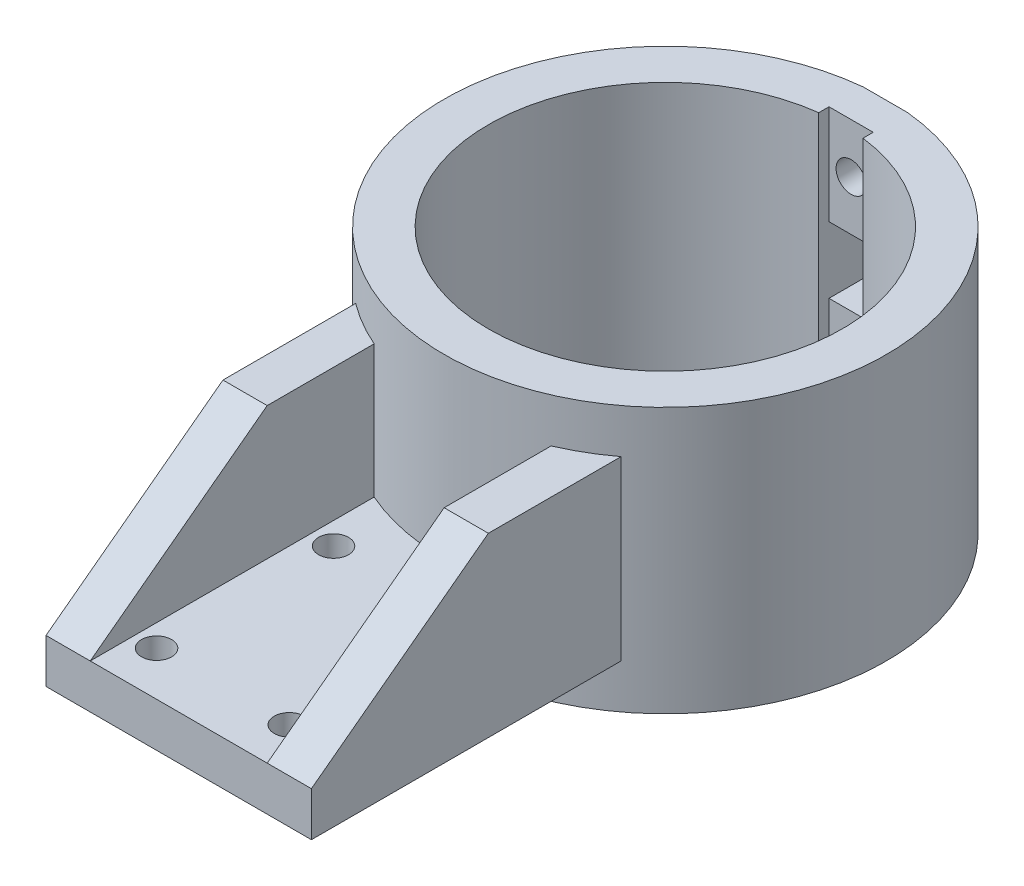
from build123d import *

# Parameters (mm, degrees)
SKETCH1_R             = 50
SKETCH1_R_2           = 40
EXTRUDE1_DEPTH        = 60
EXTRUDE2_REACH        = 128.886
EXTRUDE2_END_RADIUS   = 50
EXTRUDE5_DEPTH        = 60
EXTRUDE6_DEPTH        = 149.660687473
EXTRUDE6_DEPTH_BACK   = 149.660687473
SKETCH10_W            = 10
SKETCH10_H            = 4
SKETCH10_H_2          = 0.50125629
EXTRUDE7_DEPTH        = 135.907375632
EXTRUDE8_REACH        = 179.82
SKETCH11_W            = 10
SKETCH11_H            = 15
M8_TAPPED_HOLE2_D     = 6.8
M8_TAPPED_HOLE2_DEPTH = 19.75
M8_TAPPED_HOLE2_TIP   = 2.042926105
M8_TAPPED_HOLE3_D     = 6.8
M8_TAPPED_HOLE3_DEPTH = 19.75
M8_TAPPED_HOLE3_TIP   = 2.042926105


with BuildPart() as part:
    # Sketch1 → Extrude1 (new body)
    with BuildSketch(Plane(origin=(0, 0, 0), x_dir=(1, 0, 0), z_dir=(0, 1, 0))):
        with Locations(Location((0, 0, 0), (0, 0, 270))):
            Circle(SKETCH1_R)
        with Locations(Location((0, 0, 0), (0, 0, 270))):
            Circle(SKETCH1_R_2, mode=Mode.SUBTRACT)
    extrude(amount=EXTRUDE1_DEPTH)

    # Extrude2: up to this cylinder (the profile starts outside it)
    extrude2_end = Plane(origin=(0, 49.27889, 0), z_dir=(0, -1, 0)) * Cylinder(EXTRUDE2_END_RADIUS, 358.772, mode=Mode.PRIVATE)
    # Sketch2 → Extrude2 (add, up to the surface)
    with BuildSketch(Plane.XY.offset(50), mode=Mode.PRIVATE) as extrude2_sk1:
        Polygon((-30, 50), (-20, 50), (-20, 20), (20, 20), (20, 50), (30, 50), (30, 10), (-30, 10), align=None)
    extrude2_tool1 = extrude(extrude2_sk1.sketch, amount=-EXTRUDE2_REACH, mode=Mode.PRIVATE) - extrude2_end
    add(extrude2_tool1.solids().sort_by_distance((-25, 49.27889, 50))[0])
    add(extrude2_tool1.solids().sort_by_distance((-25, 49.27889, 50))[1])

    # Sketch8 → Extrude5 (add)
    with BuildSketch(Plane.XY.offset(50)):
        Polygon((20, 20), (0, 20), (-20, 20), (-20, 50), (-30, 50), (-30, 10), (0, 10), (30, 10), (30, 50), (20, 50), align=None)
    extrude(amount=EXTRUDE5_DEPTH)

    # Sketch9 → Extrude6 (cut, two sides: drawn at the far end of the back side and taken through both)
    with BuildSketch(Plane.ZY.offset(30).offset(-EXTRUDE6_DEPTH_BACK)):
        Polygon((110, 50), (110, 20), (70, 50), align=None)
    extrude(amount=EXTRUDE6_DEPTH + EXTRUDE6_DEPTH_BACK, mode=Mode.SUBTRACT)

    # Sketch10 → Extrude7 (cut, through all)
    with BuildSketch(Plane(origin=(0, 60, 0), x_dir=(1, 0, 0), z_dir=(0, 1, 0))):
        with Locations((0, 40)):
            Rectangle(SKETCH10_W, SKETCH10_H)
        with Locations((0, 50)):
            Rectangle(SKETCH10_W, SKETCH10_H_2)
    extrude(amount=-EXTRUDE7_DEPTH, mode=Mode.SUBTRACT)

    # Sketch11 → Extrude8 (cut, up to next)
    with BuildSketch(Plane(origin=(0, 0, -49.749371855), x_dir=(-1, 0, 0), z_dir=(0, 0, -1)), mode=Mode.PRIVATE) as extrude8_sk1:
        with Locations((0, 30)):
            Rectangle(SKETCH11_W, SKETCH11_H)
    extrude8_tool1 = extrude(extrude8_sk1.sketch, amount=-EXTRUDE8_REACH, mode=Mode.PRIVATE) & part.part
    add(extrude8_tool1.solids().sort_by_distance((0, 30, -49.749372))[0], mode=Mode.SUBTRACT)

    # M8 Tapped Hole2
    with Locations(Plane(origin=(0, 48.75, -49.749371855), x_dir=(-1, 0, 0), z_dir=(0, 0, -1))):
        with Locations((0, 0), (0, -37.5)):
            Hole(M8_TAPPED_HOLE2_D / 2, depth=M8_TAPPED_HOLE2_DEPTH)
            with Locations((0, 0, -(M8_TAPPED_HOLE2_DEPTH + M8_TAPPED_HOLE2_TIP / 2))):  # 118° drill point
                Cone(0, M8_TAPPED_HOLE2_D / 2, M8_TAPPED_HOLE2_TIP, mode=Mode.SUBTRACT)

    # M8 Tapped Hole3
    with Locations(Plane(origin=(-15, 20, 60), x_dir=(0, 0, 1), z_dir=(0, 1, 0))):
        with Locations((0, 0), (0, 30), (40, 0), (40, 30)):
            Hole(M8_TAPPED_HOLE3_D / 2, depth=M8_TAPPED_HOLE3_DEPTH)
            with Locations((0, 0, -(M8_TAPPED_HOLE3_DEPTH + M8_TAPPED_HOLE3_TIP / 2))):  # 118° drill point
                Cone(0, M8_TAPPED_HOLE3_D / 2, M8_TAPPED_HOLE3_TIP, mode=Mode.SUBTRACT)


solid = part.part
